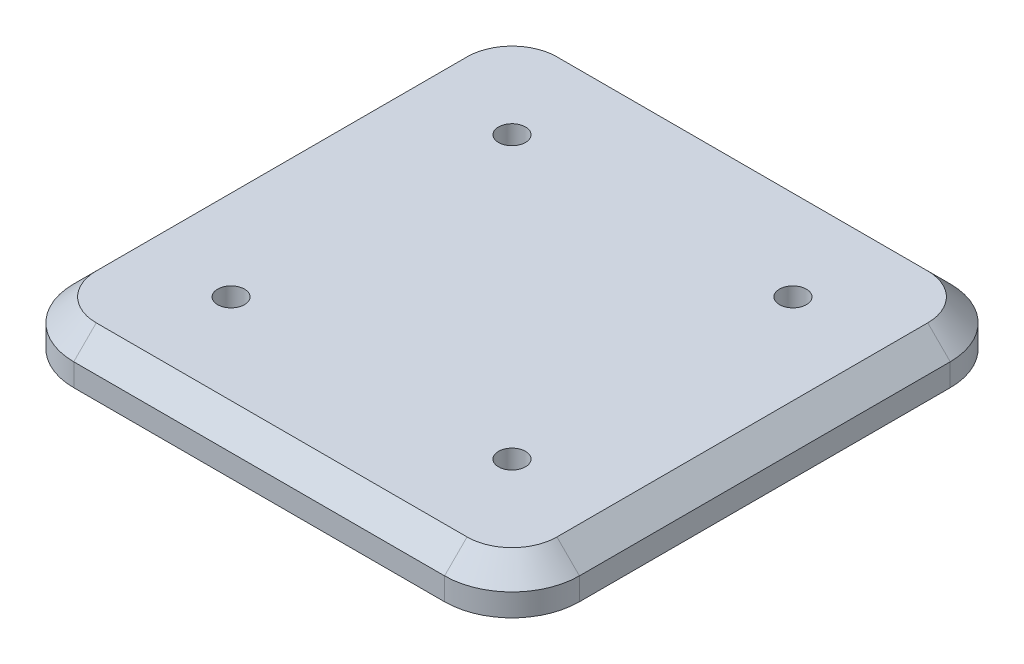
from build123d import *

# Parameters (mm, degrees)
SKETCH_1_W                 = 225
SKETCH_1_H                 = 225
EXTRUDE_1_DEPTH            = 20
FILLET_1_R                 = 30
CHAMFER_1_SIZE             = 10
F_20_0MM_1_D               = 12
F_20_0MM_1_DEPTH           = 10
F_20_0MM_1_TIP             = 3.605163714
F_20_0MM_1_ON_FACE_2_D     = 12
F_20_0MM_1_ON_FACE_2_DEPTH = 10
F_20_0MM_1_ON_FACE_2_TIP   = 3.605163714


with BuildPart() as part:
    # 草圖1 → 填料-伸長1 (new body)
    with BuildSketch(Plane(origin=(0, 0, 0), x_dir=(1, 0, 0), z_dir=(0, 1, 0))):
        with Locations((112.5, 112.5)):
            Rectangle(SKETCH_1_W, SKETCH_1_H)
    extrude(amount=EXTRUDE_1_DEPTH)

    # 圓角1
    fillet_1_edges = [part.edges().sort_by_distance(p)[0] for p in [
        (0, 10, -225),
        (225, 10, -225),
        (225, 10, 0),
        (0, 10, 0),
    ]]
    fillet(fillet_1_edges, radius=FILLET_1_R)

    # 導角1
    chamfer_1_edges = [part.edges().sort_by_distance(p)[0] for p in [
        (0, 20, -112.5),
        (112.5, 20, -225),
        (112.5, 20, 0),
        (225, 20, -112.5),
        (8.786796564, 20, -8.786796564),
        (216.213203436, 20, -8.786796564),
        (216.213203436, 20, -216.213203436),
        (8.786796564, 20, -216.213203436),
    ]]
    chamfer(chamfer_1_edges, length=CHAMFER_1_SIZE)

    # Ø20.0mm 定位孔1
    with Locations(Plane(origin=(50, 20, -50), x_dir=(0, 0, 1), z_dir=(0, 1, 0))):
        with Locations((0, 0), (-125, 0), (-125, 125), (0, 125)):
            Hole(F_20_0MM_1_D / 2, depth=F_20_0MM_1_DEPTH)
            with Locations((0, 0, -(F_20_0MM_1_DEPTH + F_20_0MM_1_TIP / 2))):  # 118° drill point
                Cone(0, F_20_0MM_1_D / 2, F_20_0MM_1_TIP, mode=Mode.SUBTRACT)

    # Ø20.0mm 定位孔1 on face 2
    with Locations(Plane(origin=(25, 0, -25), x_dir=(0, 0, -1), z_dir=(0, -1, 0))):
        with Locations((0, 0), (0, 175), (175, 175), (175, 0)):
            Hole(F_20_0MM_1_ON_FACE_2_D / 2, depth=F_20_0MM_1_ON_FACE_2_DEPTH)
            with Locations((0, 0, -(F_20_0MM_1_ON_FACE_2_DEPTH + F_20_0MM_1_ON_FACE_2_TIP / 2))):  # 118° drill point
                Cone(0, F_20_0MM_1_ON_FACE_2_D / 2, F_20_0MM_1_ON_FACE_2_TIP, mode=Mode.SUBTRACT)


solid = part.part
